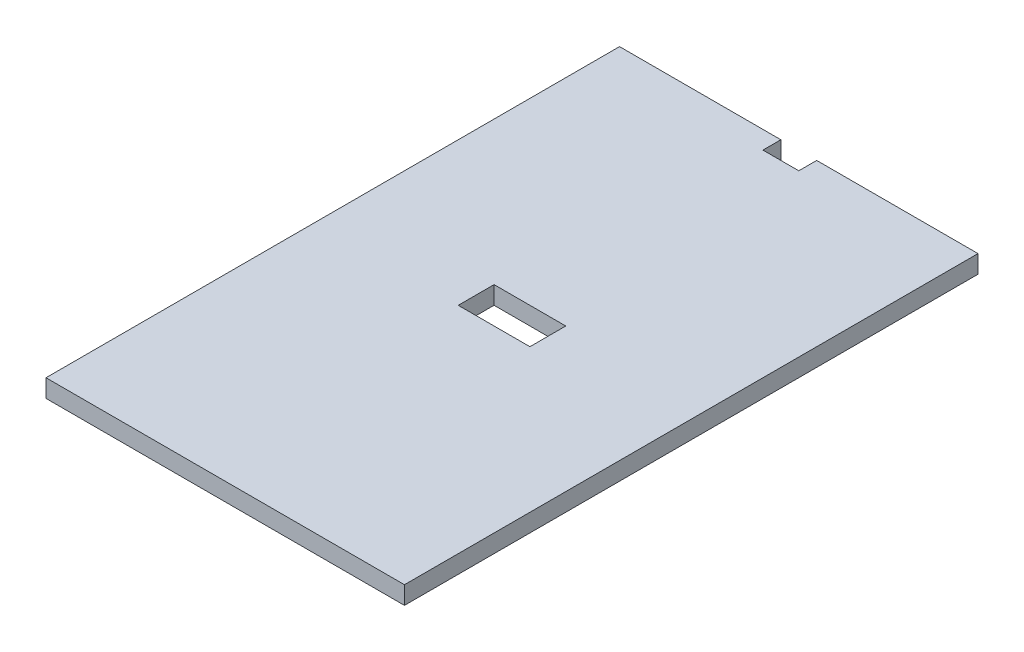
from build123d import *

# Parameters (mm, degrees)
SKIZZE1_W                       = 100
SKIZZE1_H                       = 160
SKIZZE1_W_2                     = 20
SKIZZE1_H_2                     = 10
AUFSATZ_LINEAR_AUSTRAGEN1_DEPTH = 5
SKIZZE2_W                       = 10
SKIZZE2_H                       = 5
SCHNITT_LINEAR_AUSTRAGEN1_DEPTH = 95.472218138


with BuildPart() as part:
    # Skizze1 → Aufsatz-Linear austragen1 (new body)
    with BuildSketch(Plane(origin=(0, 0, 0), x_dir=(1, 0, 0), z_dir=(0, 1, 0))):
        Rectangle(SKIZZE1_W, SKIZZE1_H)
        Rectangle(SKIZZE1_W_2, SKIZZE1_H_2, mode=Mode.SUBTRACT)
    extrude(amount=AUFSATZ_LINEAR_AUSTRAGEN1_DEPTH)

    # Skizze2 → Schnitt-Linear austragen1 (cut, through all)
    with BuildSketch(Plane(origin=(0, 5, 0), x_dir=(1, 0, 0), z_dir=(0, 1, 0))):
        with Locations((0, 77.5)):
            Rectangle(SKIZZE2_W, SKIZZE2_H)
    extrude(amount=-SCHNITT_LINEAR_AUSTRAGEN1_DEPTH, mode=Mode.SUBTRACT)


solid = part.part
